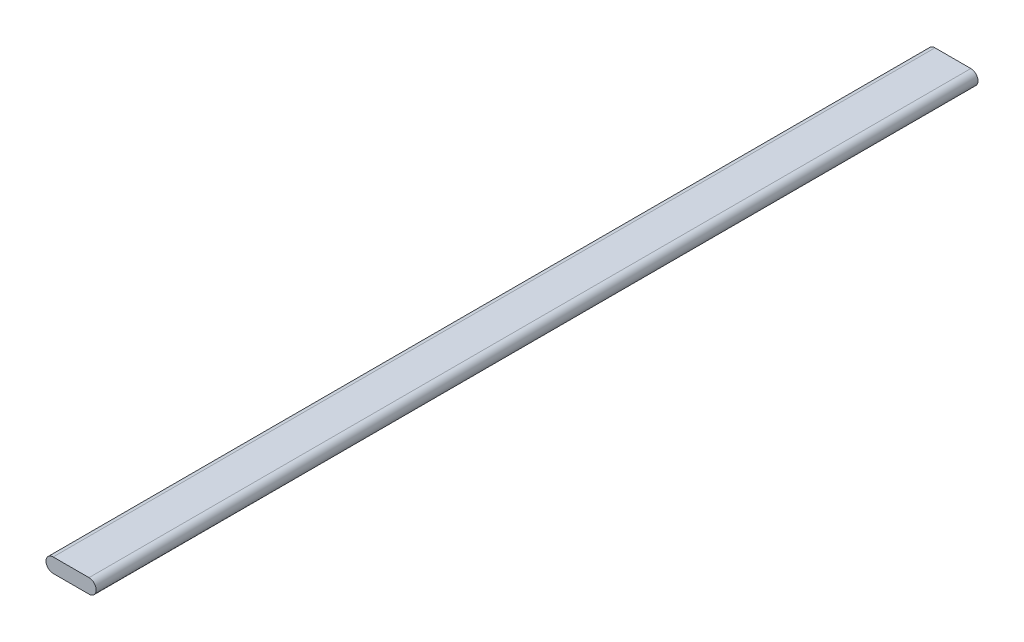
from build123d import *

# Parameters (mm, degrees)
BOSS_EXTRUDE1_DEPTH = 615
SKETCH2_R           = 4
CUT_EXTRUDE1_DEPTH  = 5


with BuildPart() as part:
    # Sketch1 → Boss-Extrude1 (new body)
    with BuildSketch(Plane.XY):
        with BuildLine():
            Line((-12.5, 5), (12.5, 5))
            ThreePointArc((12.5, 5), (17.5, 0), (12.5, -5))
            Line((12.5, -5), (-12.5, -5))
            ThreePointArc((-12.5, -5), (-17.5, 0), (-12.5, 5))
        make_face()
    extrude(amount=-BOSS_EXTRUDE1_DEPTH)

    # Sketch2 → Cut-Extrude1 (cut)
    with BuildSketch(Plane.XZ.offset(5)):
        with Locations(Location((0, -15, 0), (0, 0, 270))):
            Circle(SKETCH2_R)
        with Locations(Location((0, -600, 0), (0, 0, 270))):
            Circle(SKETCH2_R)
    extrude(amount=-CUT_EXTRUDE1_DEPTH, mode=Mode.SUBTRACT)


solid = part.part
